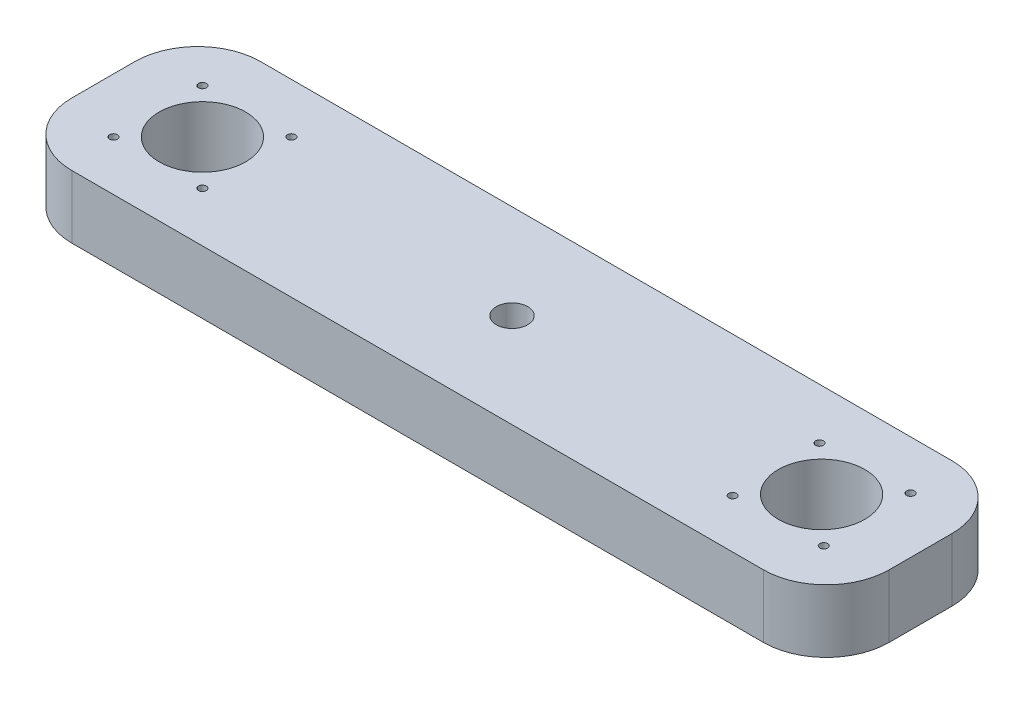
from build123d import *

# Parameters (mm, degrees)
BOSS_EXTRUDE1_DEPTH = 25.4
CUT_EXTRUDE1_REACH  = 265.241
SKETCH5_R           = 6.35
SKETCH5_R_2         = 17.4625
CUT_EXTRUDE2_REACH  = 265.241
SKETCH6_R           = 1.5875


with BuildPart() as part:
    # Sketch4 → Boss-Extrude1 (new body)
    with BuildSketch(Plane(origin=(0, 0, 0), x_dir=(1, 0, 0), z_dir=(0, 1, 0))):
        with BuildLine():
            Line((233.827945205, -38.1), (-45.372054795, -38.1))
            ThreePointArc((-45.372054795, -38.1), (-63.332567037, -30.660512242), (-70.772054795, -12.7))
            Line((-70.772054795, -12.7), (-70.772054795, 12.7))
            ThreePointArc((-70.772054795, 12.7), (-63.332567037, 30.660512242), (-45.372054795, 38.1))
            Line((-45.372054795, 38.1), (233.827945205, 38.1))
            ThreePointArc((233.827945205, 38.1), (251.788457448, 30.660512242), (259.227945205, 12.7))
            Line((259.227945205, 12.7), (259.227945205, -12.7))
            ThreePointArc((259.227945205, -12.7), (251.788457448, -30.660512242), (233.827945205, -38.1))
        make_face()
    extrude(amount=BOSS_EXTRUDE1_DEPTH)

    # Sketch5 → Cut-Extrude1 (cut, up to next)
    with BuildSketch(Plane(origin=(0, 25.4, 0), x_dir=(1, 0, 0), z_dir=(0, 1, 0)), mode=Mode.PRIVATE) as cut_extrude1_sk1:
        with Locations(Location((94.227945205, 0, 0), (0, 0, 270))):
            Circle(SKETCH5_R)
    cut_extrude1_tool1 = extrude(cut_extrude1_sk1.sketch, amount=-CUT_EXTRUDE1_REACH, mode=Mode.PRIVATE) & part.part
    # Sketch5 → Cut-Extrude1 (cut, up to next)
    with BuildSketch(Plane(origin=(0, 25.4, 0), x_dir=(1, 0, 0), z_dir=(0, 1, 0)), mode=Mode.PRIVATE) as cut_extrude1_sk2:
        with Locations(Location((-30.772054795, 0, 0), (0, 0, 270))):
            Circle(SKETCH5_R_2)
    cut_extrude1_tool2 = extrude(cut_extrude1_sk2.sketch, amount=-CUT_EXTRUDE1_REACH, mode=Mode.PRIVATE) & part.part
    # Sketch5 → Cut-Extrude1 (cut, up to next)
    with BuildSketch(Plane(origin=(0, 25.4, 0), x_dir=(1, 0, 0), z_dir=(0, 1, 0)), mode=Mode.PRIVATE) as cut_extrude1_sk3:
        with Locations(Location((219.227945205, 0, 0), (0, 0, 270))):
            Circle(SKETCH5_R_2)
    cut_extrude1_tool3 = extrude(cut_extrude1_sk3.sketch, amount=-CUT_EXTRUDE1_REACH, mode=Mode.PRIVATE) & part.part
    add(cut_extrude1_tool1.solids().sort_by_distance((94.227945, 25.4, 0))[0], mode=Mode.SUBTRACT)
    add(cut_extrude1_tool2.solids().sort_by_distance((-30.772055, 25.4, 0))[0], mode=Mode.SUBTRACT)
    add(cut_extrude1_tool3.solids().sort_by_distance((219.227945, 25.4, 0))[0], mode=Mode.SUBTRACT)

    # Sketch6 → Cut-Extrude2 (cut, up to next)
    with BuildSketch(Plane.XZ, mode=Mode.PRIVATE) as cut_extrude2_sk1:
        with Locations(Location((201.709555727, 18.392009952, 0), (0, 0, 270))):
            Circle(SKETCH6_R)
    cut_extrude2_tool1 = extrude(cut_extrude2_sk1.sketch, amount=-CUT_EXTRUDE2_REACH, mode=Mode.PRIVATE) & part.part
    # Sketch6 → Cut-Extrude2 (cut, up to next)
    with BuildSketch(Plane.XZ, mode=Mode.PRIVATE) as cut_extrude2_sk2:
        with Locations(Location((237.619955157, 17.518389479, 0), (0, 0, 270))):
            Circle(SKETCH6_R)
    cut_extrude2_tool2 = extrude(cut_extrude2_sk2.sketch, amount=-CUT_EXTRUDE2_REACH, mode=Mode.PRIVATE) & part.part
    # Sketch6 → Cut-Extrude2 (cut, up to next)
    with BuildSketch(Plane.XZ, mode=Mode.PRIVATE) as cut_extrude2_sk3:
        with Locations(Location((236.746334684, -18.392009952, 0), (0, 0, 270))):
            Circle(SKETCH6_R)
    cut_extrude2_tool3 = extrude(cut_extrude2_sk3.sketch, amount=-CUT_EXTRUDE2_REACH, mode=Mode.PRIVATE) & part.part
    # Sketch6 → Cut-Extrude2 (cut, up to next)
    with BuildSketch(Plane.XZ, mode=Mode.PRIVATE) as cut_extrude2_sk4:
        with Locations(Location((200.835935254, -17.518389479, 0), (0, 0, 270))):
            Circle(SKETCH6_R)
    cut_extrude2_tool4 = extrude(cut_extrude2_sk4.sketch, amount=-CUT_EXTRUDE2_REACH, mode=Mode.PRIVATE) & part.part
    # Sketch6 → Cut-Extrude2 (cut, up to next)
    with BuildSketch(Plane.XZ, mode=Mode.PRIVATE) as cut_extrude2_sk5:
        with Locations(Location((-48.732567037, 17.960512242, 0), (0, 0, 270))):
            Circle(SKETCH6_R)
    cut_extrude2_tool5 = extrude(cut_extrude2_sk5.sketch, amount=-CUT_EXTRUDE2_REACH, mode=Mode.PRIVATE) & part.part
    # Sketch6 → Cut-Extrude2 (cut, up to next)
    with BuildSketch(Plane.XZ, mode=Mode.PRIVATE) as cut_extrude2_sk6:
        with Locations(Location((-12.811542552, 17.960512242, 0), (0, 0, 270))):
            Circle(SKETCH6_R)
    cut_extrude2_tool6 = extrude(cut_extrude2_sk6.sketch, amount=-CUT_EXTRUDE2_REACH, mode=Mode.PRIVATE) & part.part
    # Sketch6 → Cut-Extrude2 (cut, up to next)
    with BuildSketch(Plane.XZ, mode=Mode.PRIVATE) as cut_extrude2_sk7:
        with Locations(Location((-12.811542552, -17.960512242, 0), (0, 0, 270))):
            Circle(SKETCH6_R)
    cut_extrude2_tool7 = extrude(cut_extrude2_sk7.sketch, amount=-CUT_EXTRUDE2_REACH, mode=Mode.PRIVATE) & part.part
    # Sketch6 → Cut-Extrude2 (cut, up to next)
    with BuildSketch(Plane.XZ, mode=Mode.PRIVATE) as cut_extrude2_sk8:
        with Locations(Location((-48.732567037, -17.960512242, 0), (0, 0, 270))):
            Circle(SKETCH6_R)
    cut_extrude2_tool8 = extrude(cut_extrude2_sk8.sketch, amount=-CUT_EXTRUDE2_REACH, mode=Mode.PRIVATE) & part.part
    add(cut_extrude2_tool1.solids().sort_by_distance((201.709556, 0, 18.39201))[0], mode=Mode.SUBTRACT)
    add(cut_extrude2_tool2.solids().sort_by_distance((237.619955, 0, 17.518389))[0], mode=Mode.SUBTRACT)
    add(cut_extrude2_tool3.solids().sort_by_distance((236.746335, 0, -18.39201))[0], mode=Mode.SUBTRACT)
    add(cut_extrude2_tool4.solids().sort_by_distance((200.835935, 0, -17.518389))[0], mode=Mode.SUBTRACT)
    add(cut_extrude2_tool5.solids().sort_by_distance((-48.732567, 0, 17.960512))[0], mode=Mode.SUBTRACT)
    add(cut_extrude2_tool6.solids().sort_by_distance((-12.811543, 0, 17.960512))[0], mode=Mode.SUBTRACT)
    add(cut_extrude2_tool7.solids().sort_by_distance((-12.811543, 0, -17.960512))[0], mode=Mode.SUBTRACT)
    add(cut_extrude2_tool8.solids().sort_by_distance((-48.732567, 0, -17.960512))[0], mode=Mode.SUBTRACT)


solid = part.part
